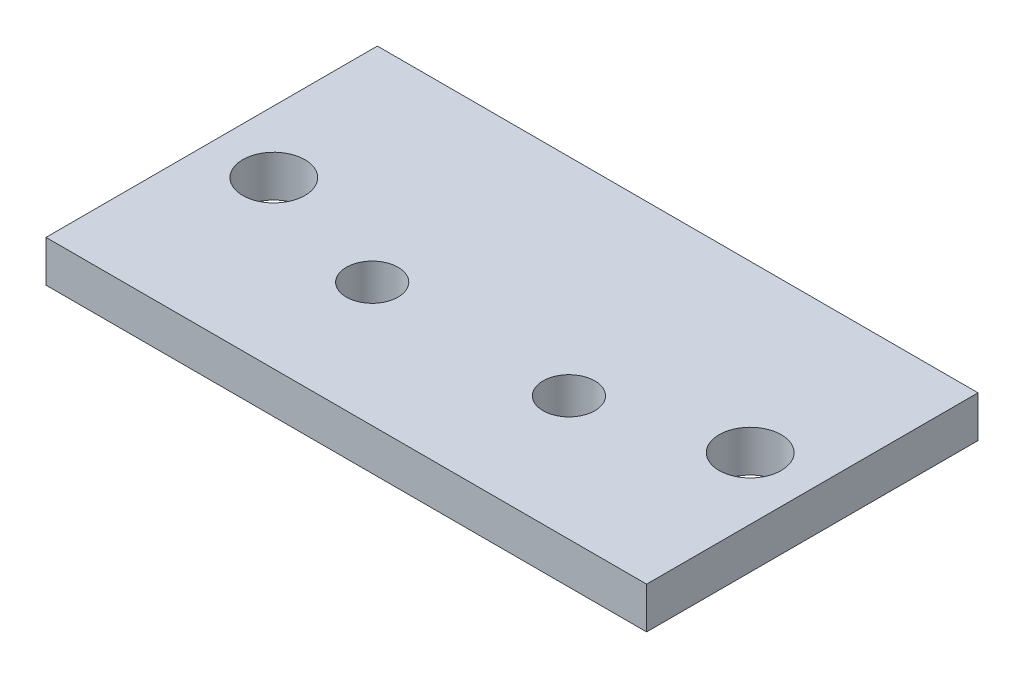
from build123d import *

# Parameters (mm, degrees)
CROQUIS1_W              = 29
CROQUIS1_H              = 16
CROQUIS1_R              = 1.5
CROQUIS1_R_2            = 1.25
SALIENTE_EXTRUIR1_DEPTH = 2


with BuildPart() as part:
    # Croquis1 → Saliente-Extruir1 (new body)
    with BuildSketch(Plane(origin=(0, 0, 0), x_dir=(1, 0, 0), z_dir=(0, 1, 0))):
        Rectangle(CROQUIS1_W, CROQUIS1_H)
        with Locations(Location((11.5, 0, 0), (0, 0, 270))):
            Circle(CROQUIS1_R, mode=Mode.SUBTRACT)
        with Locations(Location((-11.5, 0, 0), (0, 0, 90))):
            Circle(CROQUIS1_R, mode=Mode.SUBTRACT)
        with Locations(Location((-4.75, -2, 0), (0, 0, 270))):
            Circle(CROQUIS1_R_2, mode=Mode.SUBTRACT)
        with Locations(Location((4.75, -2, 0), (0, 0, 90))):
            Circle(CROQUIS1_R_2, mode=Mode.SUBTRACT)
    extrude(amount=SALIENTE_EXTRUIR1_DEPTH)


solid = part.part
